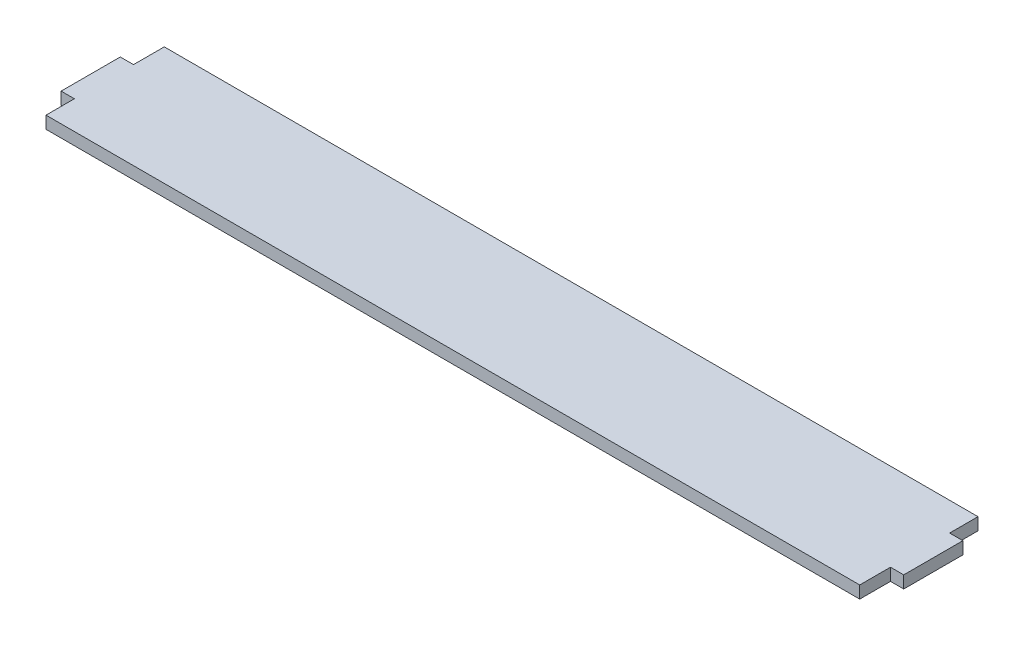
from build123d import *

# Parameters (mm, degrees)
SKETCH1_W           = 86
SKETCH1_H           = 12.5
BOSS_EXTRUDE1_DEPTH = 1.3
SKETCH2_W           = 1.4
SKETCH2_H           = 6.25
BOSS_EXTRUDE2_DEPTH = 1.3


with BuildPart() as part:
    # Sketch1 → Boss-Extrude1 (new body)
    with BuildSketch(Plane(origin=(0, 0, 0), x_dir=(1, 0, 0), z_dir=(0, 1, 0))):
        Rectangle(SKETCH1_W, SKETCH1_H)
    extrude(amount=BOSS_EXTRUDE1_DEPTH)

    # Sketch2 → Boss-Extrude2 (add)
    with BuildSketch(Plane(origin=(0, 0, 0), x_dir=(1, 0, 0), z_dir=(0, 1, 0))):
        with Locations((-43.7, -0.125)):
            Rectangle(SKETCH2_W, SKETCH2_H)
        with Locations((43.7, 0.125)):
            Rectangle(SKETCH2_W, SKETCH2_H)
    extrude(amount=BOSS_EXTRUDE2_DEPTH)


solid = part.part
